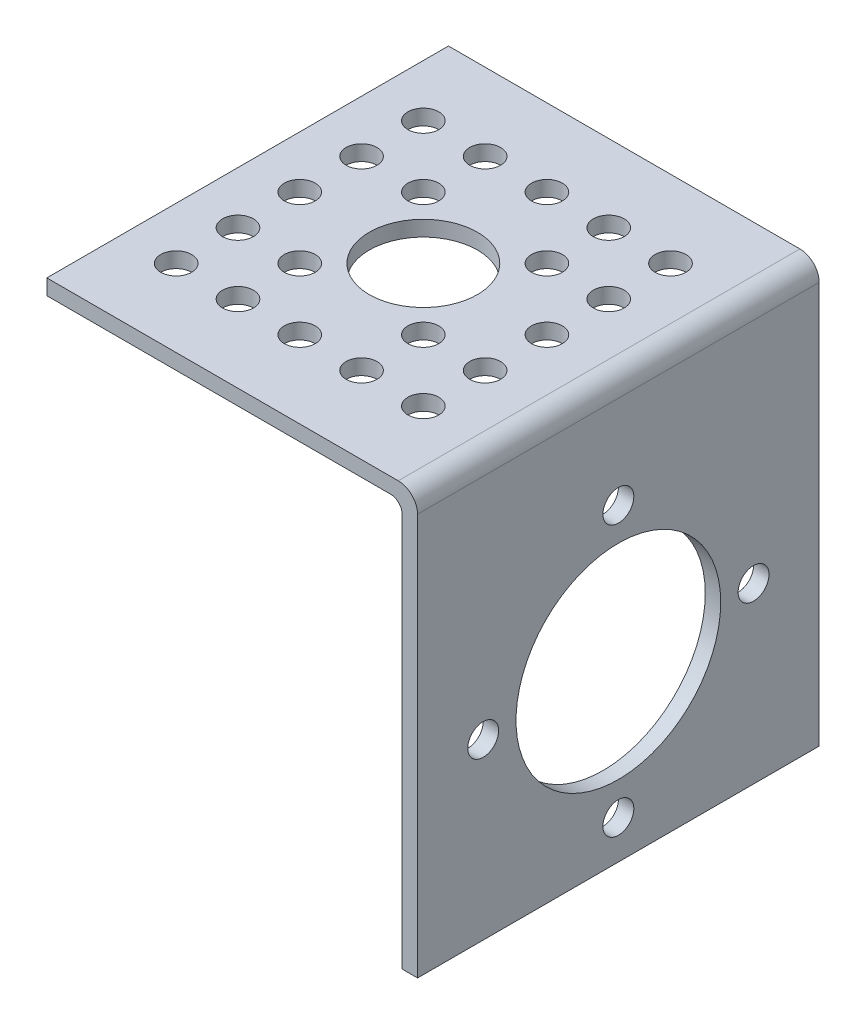
from build123d import *

# Parameters (mm, degrees)
SKETCH1_W           = 52
SKETCH1_H           = 52.5
SKETCH1_R           = 2
SKETCH1_R_2         = 13.25
BOSS_EXTRUDE1_DEPTH = 2
SKETCH3_W           = 52
SKETCH3_H           = 2
BOSS_EXTRUDE3_DEPTH = 48
FILLET1_R           = 1.5
FILLET2_R           = 2.5
SKETCH7_R           = 7
SKETCH7_R_2         = 2
CUT_EXTRUDE1_DEPTH  = 76.909485573


with BuildPart() as part:
    # Sketch1 → Boss-Extrude1 (new body)
    with BuildSketch(Plane(origin=(0, 0, 0), x_dir=(0, 0, -1), z_dir=(1, 0, 0))):
        with Locations((0, 3.75)):
            Rectangle(SKETCH1_W, SKETCH1_H)
        with Locations((0, 17.5)):
            Circle(SKETCH1_R, mode=Mode.SUBTRACT)
        with Locations((17.5, 0)):
            Circle(SKETCH1_R, mode=Mode.SUBTRACT)
        with Locations((0, -17.5)):
            Circle(SKETCH1_R, mode=Mode.SUBTRACT)
        with Locations((-17.5, 0)):
            Circle(SKETCH1_R, mode=Mode.SUBTRACT)
        Circle(SKETCH1_R_2, mode=Mode.SUBTRACT)
    extrude(amount=BOSS_EXTRUDE1_DEPTH)

    # Sketch3 → Boss-Extrude3 (add)
    with BuildSketch(Plane(origin=(2, 0, 0), x_dir=(0, 0, -1), z_dir=(1, 0, 0))):
        with Locations((0, 31)):
            Rectangle(SKETCH3_W, SKETCH3_H)
    extrude(amount=-BOSS_EXTRUDE3_DEPTH)

    # Fillet1
    fillet1_edges = [part.edges().sort_by_distance(p)[0] for p in [
        (0, 30, 0),
    ]]
    fillet(fillet1_edges, radius=FILLET1_R)

    # Fillet2
    fillet2_edges = [part.edges().sort_by_distance(p)[0] for p in [
        (2, 32, 0),
    ]]
    fillet(fillet2_edges, radius=FILLET2_R)

    # Sketch7 → Cut-Extrude1 (cut, through all)
    with BuildSketch(Plane(origin=(0, 32, 0), x_dir=(1, 0, 0), z_dir=(0, 1, 0))):
        with Locations(Location((-23.25, 0, 0), (0, 0, 270))):
            Circle(SKETCH7_R)
        with Locations(Location((-39.25, 16, 0), (0, 0, 270))):
            Circle(SKETCH7_R_2)
        with Locations(Location((-31.25, 16, 0), (0, 0, 270))):
            Circle(SKETCH7_R_2)
        with Locations(Location((-23.25, 16, 0), (0, 0, 270))):
            Circle(SKETCH7_R_2)
        with Locations(Location((-15.25, 16, 0), (0, 0, 270))):
            Circle(SKETCH7_R_2)
        with Locations(Location((-7.25, 16, 0), (0, 0, 270))):
            Circle(SKETCH7_R_2)
        with Locations(Location((-31.25, 8, 0), (0, 0, 270))):
            Circle(SKETCH7_R_2)
        with Locations(Location((-15.25, 8, 0), (0, 0, 270))):
            Circle(SKETCH7_R_2)
        with Locations(Location((-7.25, 8, 0), (0, 0, 270))):
            Circle(SKETCH7_R_2)
        with Locations(Location((-7.25, 0, 0), (0, 0, 270))):
            Circle(SKETCH7_R_2)
        with Locations(Location((-31.25, -8, 0), (0, 0, 270))):
            Circle(SKETCH7_R_2)
        with Locations(Location((-15.25, -8, 0), (0, 0, 270))):
            Circle(SKETCH7_R_2)
        with Locations(Location((-7.25, -8, 0), (0, 0, 270))):
            Circle(SKETCH7_R_2)
        with Locations(Location((-31.25, -16, 0), (0, 0, 270))):
            Circle(SKETCH7_R_2)
        with Locations(Location((-23.25, -16, 0), (0, 0, 270))):
            Circle(SKETCH7_R_2)
        with Locations(Location((-15.25, -16, 0), (0, 0, 270))):
            Circle(SKETCH7_R_2)
        with Locations(Location((-7.25, -16, 0), (0, 0, 270))):
            Circle(SKETCH7_R_2)
        with Locations(Location((-39.25, 8, 0), (0, 0, 270))):
            Circle(SKETCH7_R_2)
        with Locations(Location((-39.25, 0, 0), (0, 0, 270))):
            Circle(SKETCH7_R_2)
        with Locations(Location((-39.25, -8, 0), (0, 0, 270))):
            Circle(SKETCH7_R_2)
        with Locations(Location((-39.25, -16, 0), (0, 0, 270))):
            Circle(SKETCH7_R_2)
    extrude(amount=-CUT_EXTRUDE1_DEPTH, mode=Mode.SUBTRACT)


solid = part.part
